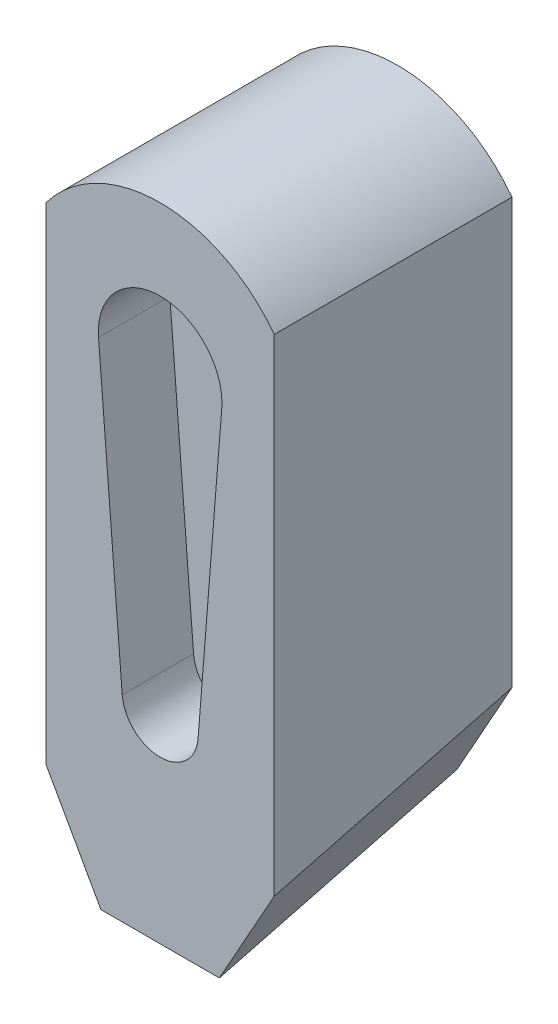
from build123d import *
from OCP.BRepFilletAPI import BRepFilletAPI_MakeChamfer

# Parameters (mm, degrees)
BOSS_EXTRUDE1_DEPTH     = 12.7
CUT_EXTRUDE1_DEPTH      = 37.367265501
CUT_EXTRUDE1_DEPTH_BACK = 3.81
CUT_EXTRUDE2_DEPTH      = 38.86900643
SKETCH4_R               = 1.5875
CUT_EXTRUDE3_DEPTH      = 29.765990614
SKETCH5_R               = 3.175
CUT_EXTRUDE4_DEPTH      = 6.35
CHAMFER1_SIZE           = 1.016
CHAMFER2_SIZE           = 5.08
CHAMFER2_SIZE2          = 2.932939367


with BuildPart() as part:
    # Sketch1 → Boss-Extrude1 (new body)
    with BuildSketch(Plane.XY):
        with BuildLine():
            Line((-6.096, 4.572), (-6.096, -33.528))
            Line((-6.096, -33.528), (6.096, -33.528))
            Line((6.096, -33.528), (6.096, 4.572))
            ThreePointArc((6.096, 4.572), (0, 7.62), (-6.096, 4.572))
        make_face()
    extrude(amount=BOSS_EXTRUDE1_DEPTH)

    # Sketch2 → Cut-Extrude1 (cut, two sides: drawn at the far end of the back side and taken through both)
    with BuildSketch(Plane.XY.offset(12.7).offset(-CUT_EXTRUDE1_DEPTH_BACK)):
        with BuildLine():
            Line((3.291584227, -0.262063492), (2.025590294, -16.163269841))
            ThreePointArc((2.025590294, -16.163269841), (0, -18.034), (-2.025590294, -16.163269841))
            Line((-2.025590294, -16.163269841), (-3.291584227, -0.262063492))
            ThreePointArc((-3.291584227, -0.262063492), (0, 3.302), (3.291584227, -0.262063492))
        make_face()
    extrude(amount=CUT_EXTRUDE1_DEPTH + CUT_EXTRUDE1_DEPTH_BACK, mode=Mode.SUBTRACT)

    # Sketch3 → Cut-Extrude2 (cut, through all)
    with BuildSketch(Plane(origin=(6.096, 0, 0), x_dir=(0, 0, -1), z_dir=(1, 0, 0))):
        Polygon((-12.7, -33.528), (-12.7, -26.67), (0, -23.368), (0, -33.528), align=None)
    extrude(amount=-CUT_EXTRUDE2_DEPTH, mode=Mode.SUBTRACT)

    # Sketch4 → Cut-Extrude3 (cut, through all)
    with BuildSketch(Plane.XY.offset(8.89)):
        Circle(SKETCH4_R)
    extrude(amount=-CUT_EXTRUDE3_DEPTH, mode=Mode.SUBTRACT)

    # Sketch5 → Cut-Extrude4 (cut)
    with BuildSketch(Plane(origin=(0, 0, 0), x_dir=(-1, 0, 0), z_dir=(0, 0, -1))):
        Circle(SKETCH5_R)
    extrude(amount=-CUT_EXTRUDE4_DEPTH, mode=Mode.SUBTRACT)

    # Chamfer1
    chamfer1_edges = [part.edges().sort_by_distance(p)[0] for p in [
        (3.175, 0, 6.35),
    ]]
    chamfer(chamfer1_edges, length=CHAMFER1_SIZE)

    # Chamfer2: one chamfer whose edges measure the first distance from different faces: ONE call of the kernel's chamfer builder (chamfer() names one face for all edges)
    chamfer2_edges_1 = [part.edges().sort_by_distance(p)[0] for p in [
        (-6.096, -25.019, 6.35),
    ]]
    chamfer2_side_1 = [part.faces().sort_by_distance(p)[0] for p in [
        (-6.096, -10.238852647, 6.468097282),
    ]]
    chamfer2_edges_2 = [part.edges().sort_by_distance(p)[0] for p in [
        (6.096, -25.019, 6.35),
    ]]
    chamfer2_side_2 = [part.faces().sort_by_distance(p)[0] for p in [
        (6.096, -10.238852647, 6.468097282),
    ]]
    chamfer2 = BRepFilletAPI_MakeChamfer(part.part.solid().wrapped)
    for e in chamfer2_edges_1:
        chamfer2.Add(CHAMFER2_SIZE, CHAMFER2_SIZE2, e.wrapped, chamfer2_side_1[0].wrapped)  # the first distance lies on this face
    for e in chamfer2_edges_2:
        chamfer2.Add(CHAMFER2_SIZE, CHAMFER2_SIZE2, e.wrapped, chamfer2_side_2[0].wrapped)  # the first distance lies on this face
    add(Compound.cast(chamfer2.Shape()), mode=Mode.REPLACE)


solid = part.part
